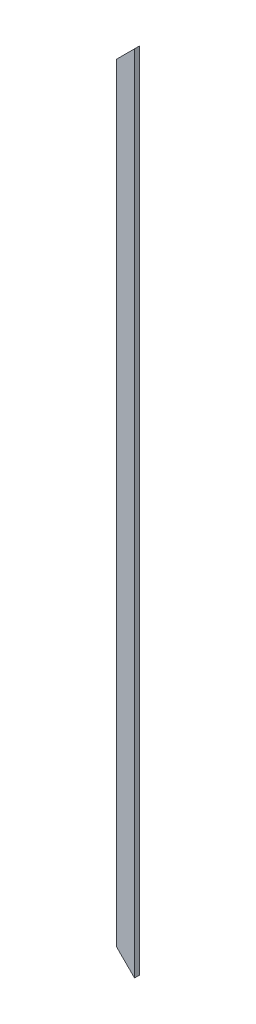
from build123d import *

# Parameters (mm, degrees)
SKETCH1_W               = 139.7
SKETCH1_H               = 38.1
BOSS_EXTRUDE1_DEPTH     = 6273.8
CUT_EXTRUDE1_DEPTH      = 6275.304509067
CUT_EXTRUDE1_DEPTH_BACK = 6275.304509067


with BuildPart() as part:
    # Sketch1 → Boss-Extrude1 (new body)
    with BuildSketch(Plane(origin=(0, 0, 0), x_dir=(1, 0, 0), z_dir=(0, 1, 0))):
        Rectangle(SKETCH1_W, SKETCH1_H)
    extrude(amount=BOSS_EXTRUDE1_DEPTH)

    # Sketch2 → Cut-Extrude1 (cut, two sides: drawn at the far end of the back side and taken through both)
    with BuildSketch(Plane.XY.offset(19.05).offset(-CUT_EXTRUDE1_DEPTH_BACK)):
        Polygon((69.85, 6273.8), (-69.85, 6134.1), (-69.85, 6273.8), align=None)
        Polygon((69.85, 0), (-69.85, 139.7), (-69.85, 0), align=None)
    extrude(amount=CUT_EXTRUDE1_DEPTH + CUT_EXTRUDE1_DEPTH_BACK, mode=Mode.SUBTRACT)


solid = part.part
